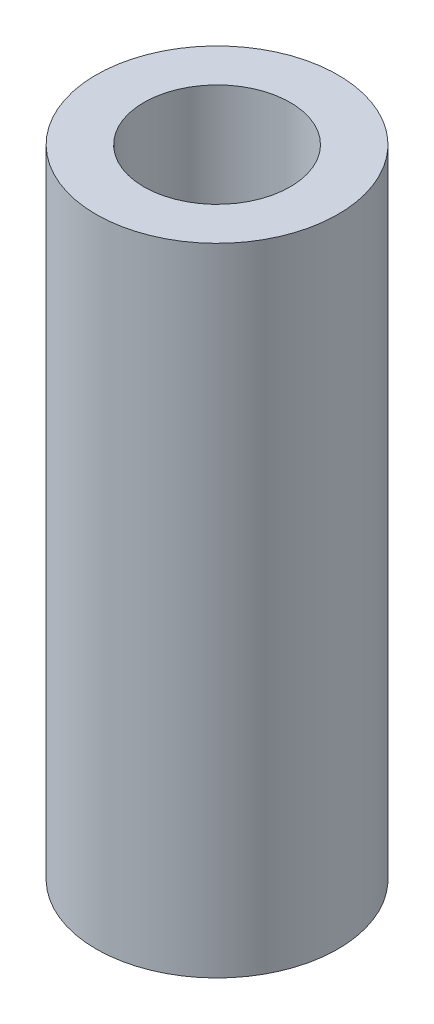
from build123d import *

# Parameters (mm, degrees)
SKETCH1_R           = 3.8
SKETCH1_R_2         = 2.3
BOSS_EXTRUDE1_DEPTH = 20


with BuildPart() as part:
    # Sketch1 → Boss-Extrude1 (new body)
    with BuildSketch(Plane(origin=(0, 0, 0), x_dir=(1, 0, 0), z_dir=(0, 1, 0))):
        with Locations(Location((0, 0, 0), (0, 0, 270))):
            Circle(SKETCH1_R)
        with Locations(Location((0, 0, 0), (0, 0, 270))):
            Circle(SKETCH1_R_2, mode=Mode.SUBTRACT)
    extrude(amount=BOSS_EXTRUDE1_DEPTH)


solid = part.part
